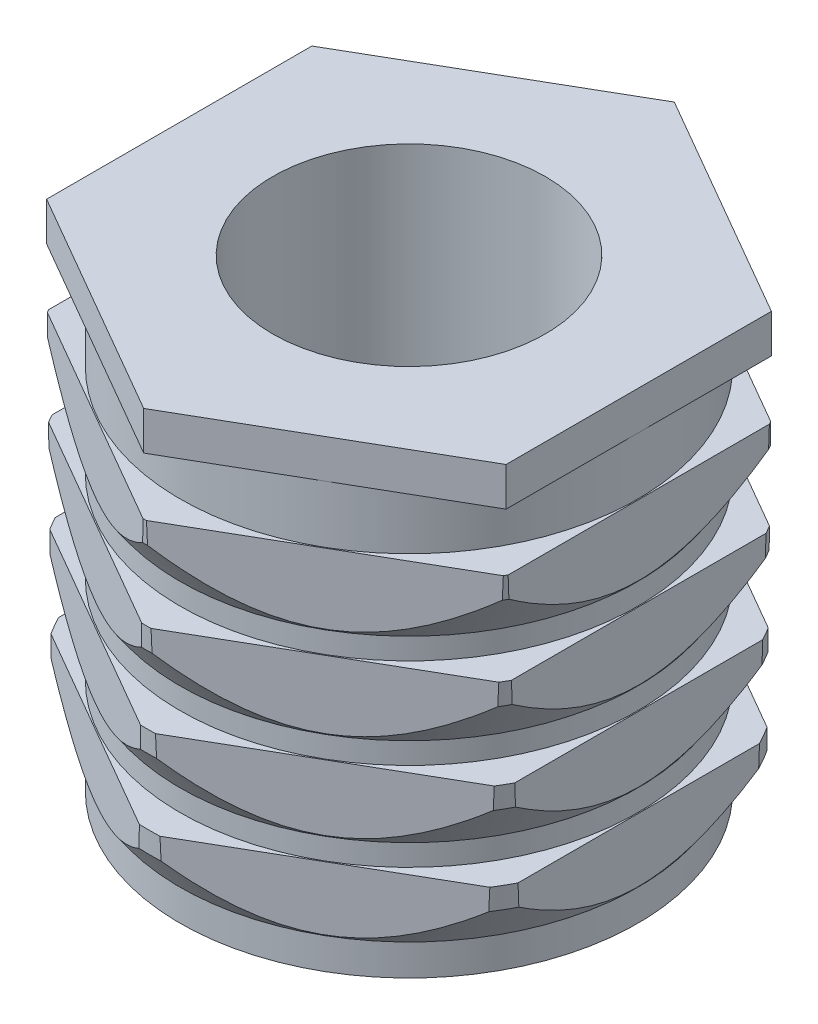
from build123d import *

# Parameters (mm, degrees)
EXTRUDE1_DEPTH = 8
SKETCH4_R      = 2.350480947
EXTRUDE2_DEPTH = 11.029476557


with BuildPart() as part:
    # Sketch1 → Extrude1 (new body)
    with BuildSketch(Plane(origin=(0, 0, 0), x_dir=(1, 0, 0), z_dir=(0, 1, 0))):
        Polygon((0, 4.572614132), (-3.96, 2.286307066), (-3.96, -2.286307066), (0, -4.572614132), (3.96, -2.286307066), (3.96, 2.286307066), align=None)
    extrude(amount=-EXTRUDE1_DEPTH)

    # Sketch4 → Extrude2 (cut, through all)
    with BuildSketch(Plane(origin=(0, 0, 0), x_dir=(-1, 0, 0), z_dir=(0, 1, 0))):
        Circle(SKETCH4_R)
    extrude(amount=-EXTRUDE2_DEPTH, mode=Mode.SUBTRACT)

    # Sketch5 → Cut-Revolve1 (revolve, cut)
    with BuildSketch(Plane.XY):
        Polygon((-3.945, -8), (-4.572614132, -8), (-5.200228264, -8), (-5.200228264, 0), (-4.572614132, 0), (-4.572614132, -0.666666667), (-3.945, -0.666666667), (-3.945, -1.666666667), (-4.555159067, -1.666666667), (-4.548720402, -2.035537527), (-3.945, -2.897739617), (-3.945, -3.266666667), (-4.527230963, -3.266666667), (-4.520792298, -3.635537527), (-3.945, -4.457854151), (-3.945, -4.826781201), (-4.499999063, -4.826781201), (-4.493560398, -5.195652062), (-3.945, -5.9790775), (-3.945, -6.34800455), (-4.47344601, -6.34800455), (-4.467007346, -6.716875411), (-3.945, -7.462379161), align=None)
    revolve(axis=Axis((0, 0, 0), (0, -1, 0)), mode=Mode.SUBTRACT)


solid = part.part
